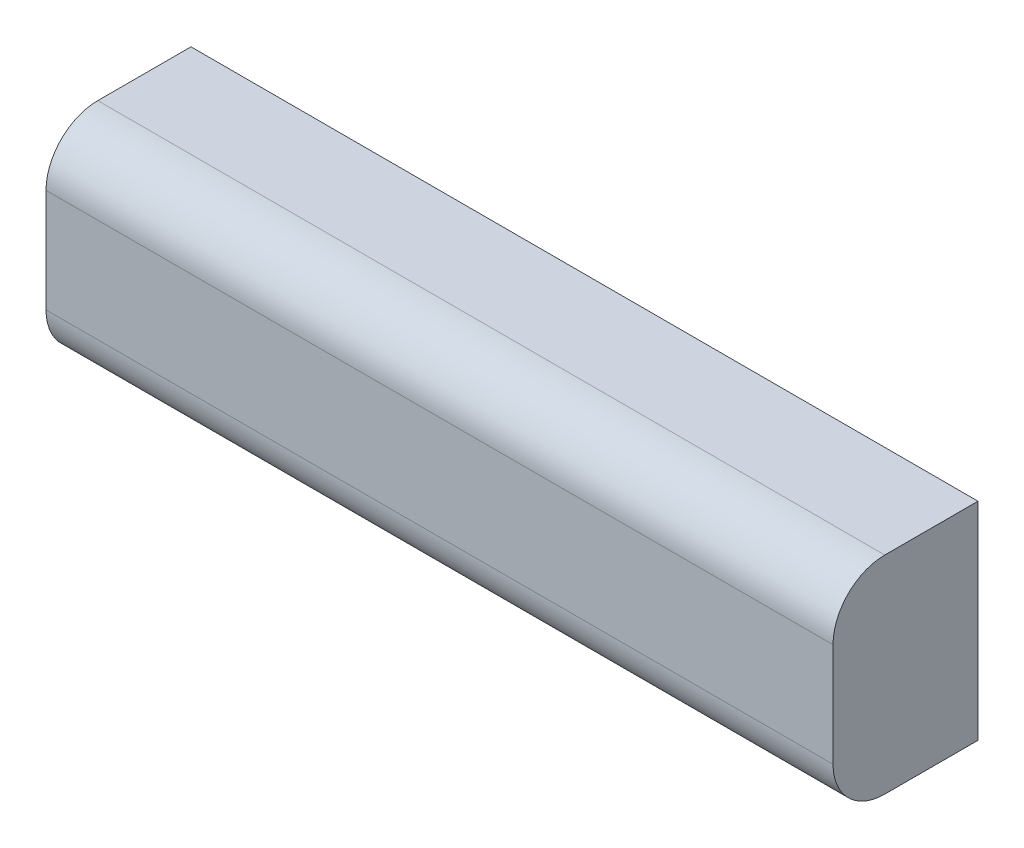
from build123d import *

# Parameters (mm, degrees)
SKETCH1_W           = 88.9
SKETCH1_H           = 127
BOSS_EXTRUDE1_DEPTH = 482.6
FILLET2_R           = 31.75


with BuildPart() as part:
    # Sketch1 → Boss-Extrude1 (new body)
    with BuildSketch(Plane(origin=(0, 0, 0), x_dir=(0, 0, -1), z_dir=(1, 0, 0))):
        with Locations((44.45, 63.5)):
            Rectangle(SKETCH1_W, SKETCH1_H)
    extrude(amount=BOSS_EXTRUDE1_DEPTH)

    # Fillet2
    fillet2_edges = [part.edges().sort_by_distance(p)[0] for p in [
        (241.3, 127, 0),
        (241.3, 0, 0),
    ]]
    fillet(fillet2_edges, radius=FILLET2_R)


solid = part.part
